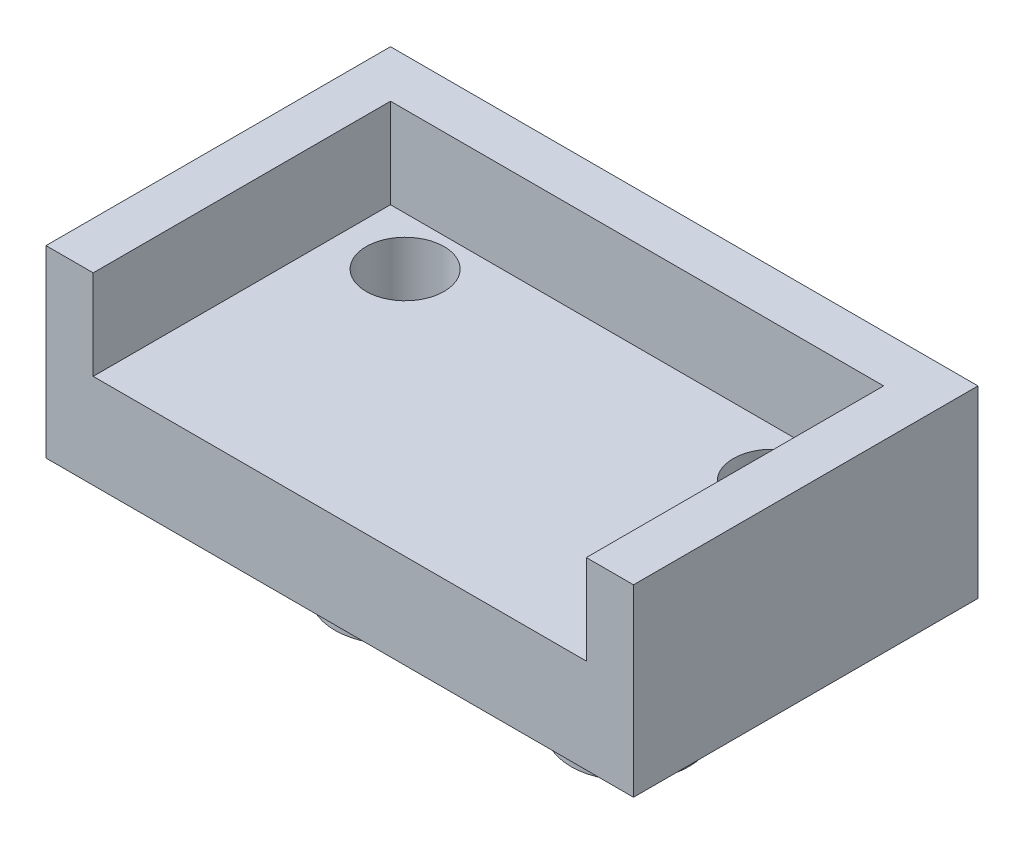
from build123d import *

# Parameters (mm, degrees)
BOSS_EXTRUDE1_DEPTH = 3.8
SKETCH1_3_W         = 20.9
SKETCH1_3_H         = 12.6
BOSS_EXTRUDE2_DEPTH = 4
SKETCH3_R           = 2.5
BOSS_EXTRUDE4_DEPTH = 5
SKETCH5_R           = 1.65
CUT_EXTRUDE1_DEPTH  = 4


with BuildPart() as part:
    # Sketch1 → Boss-Extrude1 (new body)
    with BuildSketch(Plane(origin=(0, 0, 0), x_dir=(1, 0, 0), z_dir=(0, 1, 0))):
        Polygon((22.9, 14.6), (-2, 14.6), (-2, 0), (0, 0), (0, 12.6), (20.9, 12.6), (20.9, 0), (22.9, 0), align=None)
    extrude(amount=BOSS_EXTRUDE1_DEPTH)

    # Sketch1<3> → Boss-Extrude2 (add)
    with BuildSketch(Plane(origin=(0, 0, 0), x_dir=(1, 0, 0), z_dir=(0, 1, 0))):
        with Locations((10.45, 6.3)):
            Rectangle(SKETCH1_3_W, SKETCH1_3_H)
        Polygon((22.9, 14.6), (-2, 14.6), (-2, 0), (0, 0), (0, 12.6), (20.9, 12.6), (20.9, 0), (22.9, 0), align=None)
    extrude(amount=-BOSS_EXTRUDE2_DEPTH)

    # Sketch3 → Boss-Extrude4 (add)
    with BuildSketch(Plane.XZ.offset(4)):
        with Locations(Location((5.45, -7.3, 0), (0, 0, 90))):
            Circle(SKETCH3_R)
        with Locations(Location((15.45, -7.3, 0), (0, 0, 90))):
            Circle(SKETCH3_R)
    extrude(amount=BOSS_EXTRUDE4_DEPTH)

    # Sketch5 → Cut-Extrude1 (cut)
    with BuildSketch(Plane(origin=(0, 0, 0), x_dir=(1, 0, 0), z_dir=(0, 1, 0))):
        with Locations(Location((2.67, 10.55, 0), (0, 0, 270))):
            Circle(SKETCH5_R)
        with Locations(Location((18.23, 10.55, 0), (0, 0, 270))):
            Circle(SKETCH5_R)
    extrude(amount=-CUT_EXTRUDE1_DEPTH, mode=Mode.SUBTRACT)


solid = part.part
